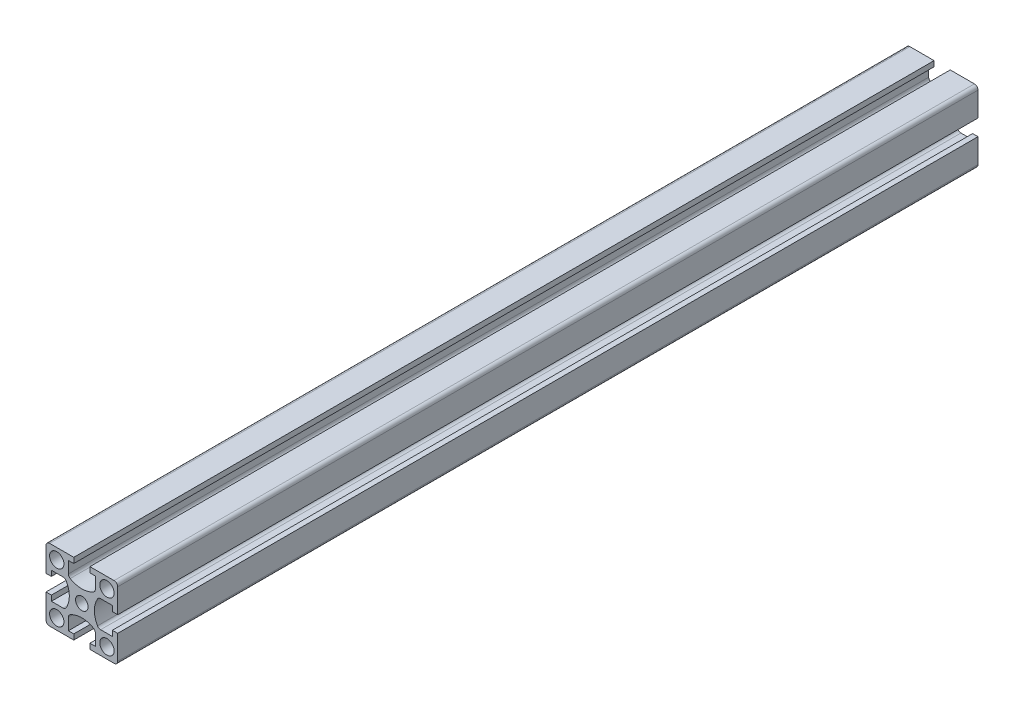
from build123d import *

# Parameters (mm, degrees)
SKETCH1_R           = 2.5
SKETCH1_R_2         = 2.1875
BOSS_EXTRUDE1_DEPTH = 300


with BuildPart() as part:
    # Sketch1 → Boss-Extrude1 (new body)
    with BuildSketch(Plane.XY):
        with BuildLine():
            Line((-12.5, 11.25), (-12.5, 2.8125))
            Line((-12.5, 2.8125), (-10.625, 2.8125))
            Line((-10.625, 2.8125), (-10.625, 4.6875))
            Line((-10.625, 4.6875), (-6.546075349, 4.6875))
            ThreePointArc((-6.546075349, 4.6875), (-5.921075349, 4.520031755), (-5.463543594, 4.0625))
            ThreePointArc((-5.463543594, 4.0625), (-4.375, 0), (-5.463543594, -4.0625))
            ThreePointArc((-5.463543594, -4.0625), (-5.921075349, -4.520031755), (-6.546075349, -4.6875))
            Line((-6.546075349, -4.6875), (-10.625, -4.6875))
            Line((-10.625, -4.6875), (-10.625, -2.8125))
            Line((-10.625, -2.8125), (-12.5, -2.8125))
            Line((-12.5, -2.8125), (-12.5, -11.25))
            ThreePointArc((-12.5, -11.25), (-12.133883476, -12.133883476), (-11.25, -12.5))
            Line((-11.25, -12.5), (-2.8125, -12.5))
            Line((-2.8125, -12.5), (-2.8125, -10.625))
            Line((-2.8125, -10.625), (-4.6875, -10.625))
            Line((-4.6875, -10.625), (-4.6875, -6.546075349))
            ThreePointArc((-4.6875, -6.546075349), (-4.520031755, -5.921075349), (-4.0625, -5.463543594))
            ThreePointArc((-4.0625, -5.463543594), (0, -4.375), (4.0625, -5.463543594))
            ThreePointArc((4.0625, -5.463543594), (4.520031755, -5.921075349), (4.6875, -6.546075349))
            Line((4.6875, -6.546075349), (4.6875, -10.625))
            Line((4.6875, -10.625), (2.8125, -10.625))
            Line((2.8125, -10.625), (2.8125, -12.5))
            Line((2.8125, -12.5), (11.25, -12.5))
            ThreePointArc((11.25, -12.5), (12.133883476, -12.133883476), (12.5, -11.25))
            Line((12.5, -11.25), (12.5, -2.8125))
            Line((12.5, -2.8125), (10.625, -2.8125))
            Line((10.625, -2.8125), (10.625, -4.6875))
            Line((10.625, -4.6875), (6.546075349, -4.6875))
            ThreePointArc((6.546075349, -4.6875), (5.921075349, -4.520031755), (5.463543594, -4.0625))
            ThreePointArc((5.463543594, -4.0625), (4.375, 0), (5.463543594, 4.0625))
            ThreePointArc((5.463543594, 4.0625), (5.921075349, 4.520031755), (6.546075349, 4.6875))
            Line((6.546075349, 4.6875), (10.625, 4.6875))
            Line((10.625, 4.6875), (10.625, 2.8125))
            Line((10.625, 2.8125), (12.5, 2.8125))
            Line((12.5, 2.8125), (12.5, 11.25))
            ThreePointArc((12.5, 11.25), (12.133883476, 12.133883476), (11.25, 12.5))
            Line((11.25, 12.5), (2.8125, 12.5))
            Line((2.8125, 12.5), (2.8125, 10.625))
            Line((2.8125, 10.625), (4.6875, 10.625))
            Line((4.6875, 10.625), (4.6875, 6.546075349))
            ThreePointArc((4.6875, 6.546075349), (4.520031755, 5.921075349), (4.0625, 5.463543594))
            ThreePointArc((4.0625, 5.463543594), (0, 4.375), (-4.0625, 5.463543594))
            ThreePointArc((-4.0625, 5.463543594), (-4.520031755, 5.921075349), (-4.6875, 6.546075349))
            Line((-4.6875, 6.546075349), (-4.6875, 10.625))
            Line((-4.6875, 10.625), (-2.8125, 10.625))
            Line((-2.8125, 10.625), (-2.8125, 12.5))
            Line((-2.8125, 12.5), (-11.25, 12.5))
            ThreePointArc((-11.25, 12.5), (-12.133883476, 12.133883476), (-12.5, 11.25))
        make_face()
        with Locations((-8.75, -8.75)):
            Circle(SKETCH1_R, mode=Mode.SUBTRACT)
        with Locations((8.75, -8.75)):
            Circle(SKETCH1_R, mode=Mode.SUBTRACT)
        with Locations((8.75, 8.75)):
            Circle(SKETCH1_R, mode=Mode.SUBTRACT)
        Circle(SKETCH1_R_2, mode=Mode.SUBTRACT)
        with Locations((-8.75, 8.75)):
            Circle(SKETCH1_R, mode=Mode.SUBTRACT)
    extrude(amount=BOSS_EXTRUDE1_DEPTH)


solid = part.part
